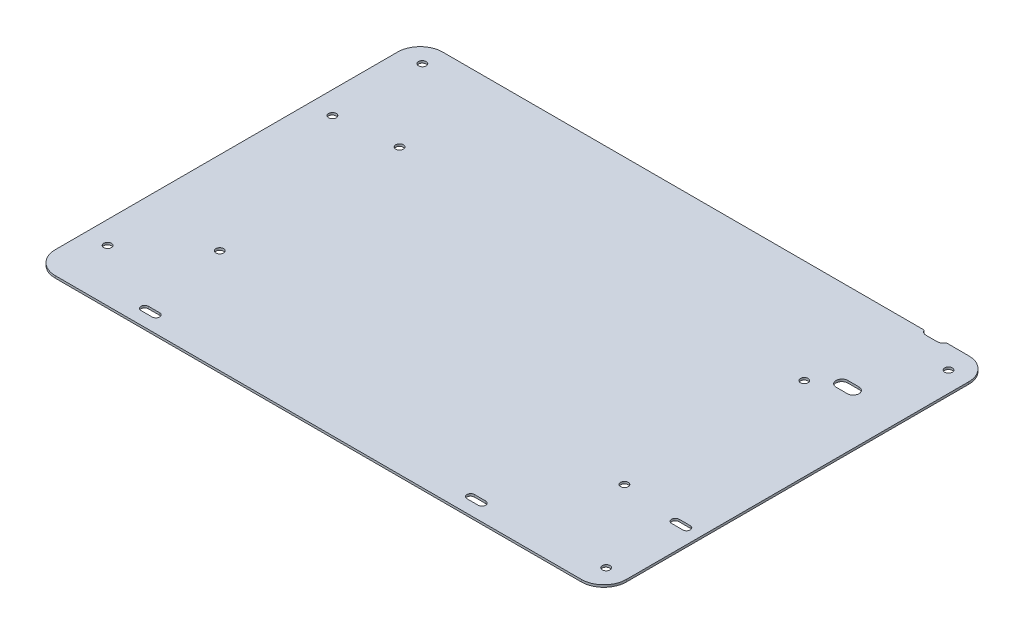
from build123d import *

# Parameters (mm, degrees)
SKETCH1_W            = 254
SKETCH1_H            = 172.27
BOSS_EXTRUDE1_DEPTH  = 1
FILLET1_R            = 10
M3_CLEARANCE_HOLE1_D = 3.4
CUT_EXTRUDE2_DEPTH   = 154.457610515


with BuildPart() as part:
    # Sketch1 → Boss-Extrude1 (new body)
    with BuildSketch(Plane(origin=(0, 0, 0), x_dir=(1, 0, 0), z_dir=(0, 1, 0))):
        Rectangle(SKETCH1_W, SKETCH1_H)
    extrude(amount=BOSS_EXTRUDE1_DEPTH)

    # Fillet1
    fillet1_edges = [part.edges().sort_by_distance(p)[0] for p in [
        (127, 0.5, 86.135),
        (-127, 0.5, 86.135),
        (-127, 0.5, -86.135),
        (127, 0.5, -86.135),
    ]]
    fillet(fillet1_edges, radius=FILLET1_R)

    # M3 Clearance Hole1 (through all)
    with Locations(Plane(origin=(0, 1, 0), x_dir=(1, 0, 0), z_dir=(0, 1, 0))):
        with Locations((-117, 77.135), (-117, -62.865), (118, -76.135), (118, 76.135), (-90, -40), (90, -40), (-90, 40), (90, 40), (-117, 37.135)):
            Hole(M3_CLEARANCE_HOLE1_D / 2)

    # Sketch6 → Cut-Extrude2 (cut, through all)
    with BuildSketch(Plane(origin=(0, 1, 0), x_dir=(1, 0, 0), z_dir=(0, 1, 0))):
        with BuildLine():
            Line((-79.5, -80.515), (-84.5, -80.515))
            ThreePointArc((-84.5, -80.515), (-86.15, -78.865), (-84.5, -77.215))
            Line((-84.5, -77.215), (-79.5, -77.215))
            ThreePointArc((-79.5, -77.215), (-77.85, -78.865), (-79.5, -80.515))
        make_face()
        with BuildLine():
            Line((120.5, -44.515), (115.5, -44.515))
            ThreePointArc((115.5, -44.515), (113.85, -42.865), (115.5, -41.215))
            Line((115.5, -41.215), (120.5, -41.215))
            ThreePointArc((120.5, -41.215), (122.15, -42.865), (120.5, -44.515))
        make_face()
        with BuildLine():
            Line((65.5, -80.515), (60.5, -80.515))
            ThreePointArc((60.5, -80.515), (58.85, -78.865), (60.5, -77.215))
            Line((60.5, -77.215), (65.5, -77.215))
            ThreePointArc((65.5, -77.215), (67.15, -78.865), (65.5, -80.515))
        make_face()
        with BuildLine():
            Line((104.6, 44.535), (99.6, 44.535))
            ThreePointArc((99.6, 44.535), (97, 47.135), (99.6, 49.735))
            Line((99.6, 49.735), (104.6, 49.735))
            ThreePointArc((104.6, 49.735), (107.2, 47.135), (104.6, 44.535))
        make_face()
        with BuildLine():
            Line((107, 86.135), (97.2, 86.135))
            ThreePointArc((97.2, 86.135), (98.15777949, 84.971669235), (99.6, 84.535))
            Line((99.6, 84.535), (104.6, 84.535))
            ThreePointArc((104.6, 84.535), (106.04222051, 84.971669235), (107, 86.135))
        make_face()
    extrude(amount=-CUT_EXTRUDE2_DEPTH, mode=Mode.SUBTRACT)


solid = part.part
